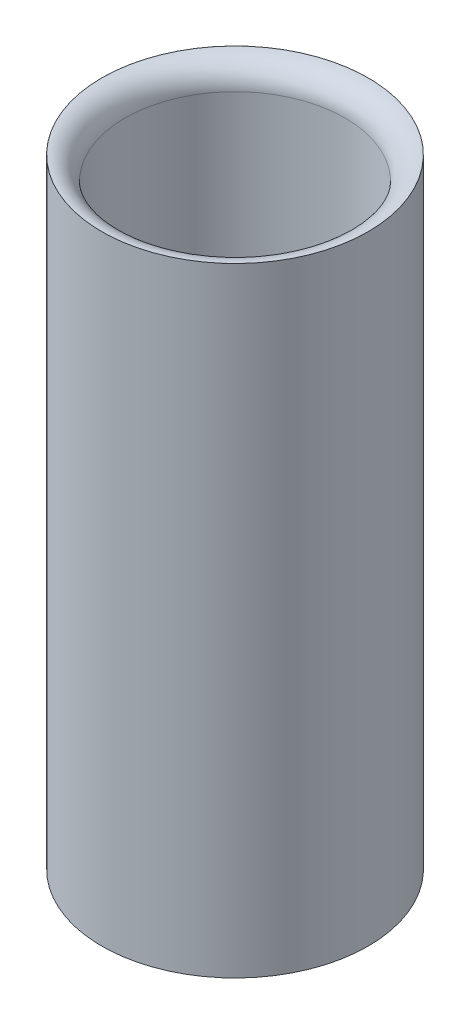
from build123d import *


with BuildPart() as part:
    # Szkic1 → Obrót1 (revolve)
    with BuildSketch(Plane.XY, mode=Mode.PRIVATE) as obr_t1_sk:
        with BuildLine():
            Line((-19.02, -51.203493976), (-22.04, -51.203493976))
            Line((-22.04, -51.203493976), (-23.04, -51.203493976))
            Line((-23.04, -51.203493976), (-23.04, -50.203493976))
            Line((-23.04, -50.203493976), (-23.04, 55.796506024))
            Line((-23.04, 55.796506024), (-23.02, 55.796506024))
            ThreePointArc((-23.02, 55.796506024), (-20.191572875, 54.624933149), (-19.02, 51.796506024))
            Line((-19.02, 51.796506024), (-19.02, -41.411476786))
            Line((-19.02, -41.411476786), (0, -41.411476786))
            Line((0, -41.411476786), (0, -50.371476786))
            Line((0, -50.371476786), (-9.51, -50.371476786))
            Line((-9.51, -50.371476786), (-19.02, -51.203493976))
        make_face()
    revolve(obr_t1_sk.sketch.rotate(Axis((0, -51.853493976, 0), (0, 1, 0)), 180), axis=Axis((0, -51.853493976, 0), (0, 1, 0)))


solid = part.part
